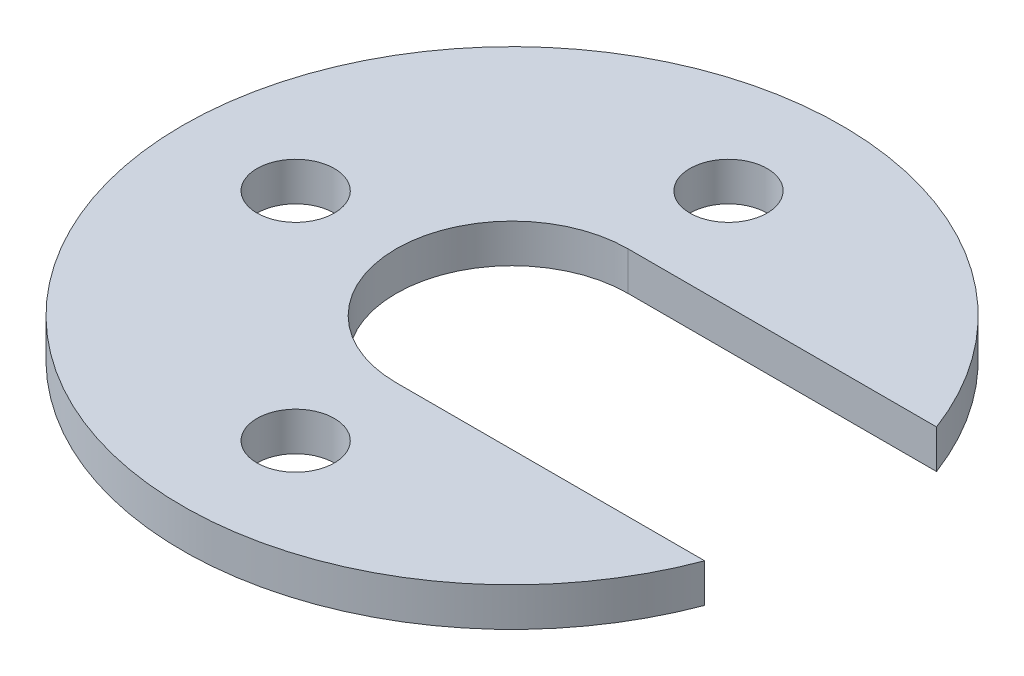
from build123d import *

# Parameters (mm, degrees)
SKETCH2_R           = 5
BOSS_EXTRUDE1_DEPTH = 5


with BuildPart() as part:
    # Sketch2 → Boss-Extrude1 (new body)
    with BuildSketch(Plane(origin=(0, 0, 0), x_dir=(1, 0, 0), z_dir=(0, 1, 0))):
        with BuildLine():
            Line((0, 15), (39.91715696, 15))
            ThreePointArc((39.91715696, 15), (-42.642460292, 0), (39.91715696, -15))
            Line((39.91715696, -15), (0, -15))
            ThreePointArc((0, -15), (-15, 0), (0, 15))
        make_face()
        with Locations(Location((0, 28, 0), (0, 0, 270))):
            Circle(SKETCH2_R, mode=Mode.SUBTRACT)
        with Locations(Location((0, -28, 0), (0, 0, 270))):
            Circle(SKETCH2_R, mode=Mode.SUBTRACT)
        with Locations(Location((-28, 0, 0), (0, 0, 270))):
            Circle(SKETCH2_R, mode=Mode.SUBTRACT)
    extrude(amount=BOSS_EXTRUDE1_DEPTH)


solid = part.part
